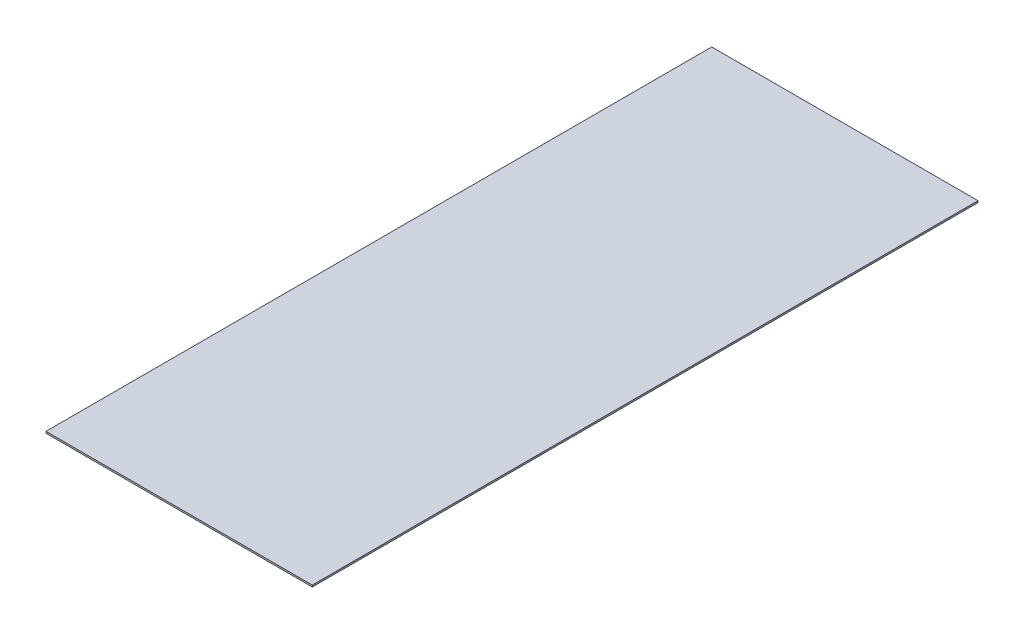
from build123d import *

# Parameters (mm, degrees)
CROQUIS1_W              = 1219.2
CROQUIS1_H              = 3048
SALIENTE_EXTRUIR1_DEPTH = 7.9


with BuildPart() as part:
    # Croquis1 → Saliente-Extruir1 (new body)
    with BuildSketch(Plane(origin=(0, 0, 0), x_dir=(1, 0, 0), z_dir=(0, 1, 0))):
        Rectangle(CROQUIS1_W, CROQUIS1_H)
    extrude(amount=SALIENTE_EXTRUIR1_DEPTH)


solid = part.part
